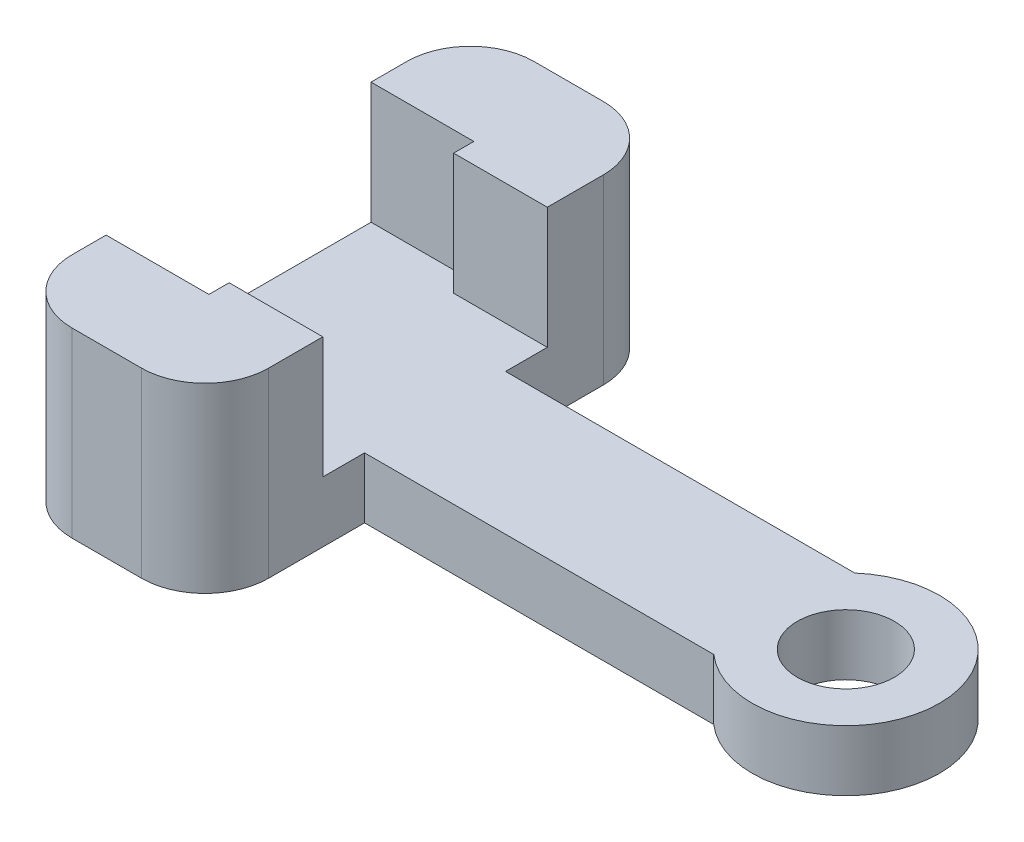
from build123d import *

# Parameters (mm, degrees)
CROQUIS1_R              = 2.4
SALIENTE_EXTRUIR1_DEPTH = 3
SALIENTE_EXTRUIR2_DEPTH = 6


with BuildPart() as part:
    # Croquis1 → Saliente-Extruir1 (new body)
    with BuildSketch(Plane(origin=(0, 0, 0), x_dir=(1, 0, 0), z_dir=(0, 1, 0))):
        with BuildLine():
            Line((35.117506554, -10.768616799), (17.851894103, -10.768616799))
            Line((17.851894103, -10.768616799), (17.851894103, -15.511473942))
            ThreePointArc((17.851894103, -15.511473942), (16.931372558, -17.73380954), (14.70903696, -18.654331085))
            Line((14.70903696, -18.654331085), (11.280465531, -18.654331085))
            ThreePointArc((11.280465531, -18.654331085), (9.058129933, -17.73380954), (8.137608389, -15.511473942))
            Line((8.137608389, -15.511473942), (8.137608389, 1.036415275))
            ThreePointArc((8.137608389, 1.036415275), (9.058129933, 3.258750873), (11.280465531, 4.179272418))
            Line((11.280465531, 4.179272418), (14.70903696, 4.179272418))
            ThreePointArc((14.70903696, 4.179272418), (16.931372558, 3.258750873), (17.851894103, 1.036415275))
            Line((17.851894103, 1.036415275), (17.851894103, -3.797188228))
            Line((17.851894103, -3.797188228), (35.117506554, -3.797188228))
            ThreePointArc((35.117506554, -3.797188228), (42.791315147, -7.282902513), (35.117506554, -10.768616799))
        make_face()
        with Locations(Location((38.162743718, -7.282902513, 0), (0, 0, 270))):
            Circle(CROQUIS1_R, mode=Mode.SUBTRACT)
    extrude(amount=SALIENTE_EXTRUIR1_DEPTH)

    # Croquis2 → Saliente-Extruir2 (add)
    with BuildSketch(Plane(origin=(0, 3, 0), x_dir=(1, 0, 0), z_dir=(0, 1, 0))):
        with BuildLine():
            Line((13.22040734, -0.732902513), (13.22040734, -1.732902513))
            Line((13.22040734, -1.732902513), (17.851894103, -1.732902513))
            Line((17.851894103, -1.732902513), (17.851894103, 1.036415275))
            ThreePointArc((17.851894103, 1.036415275), (16.931372558, 3.258750873), (14.70903696, 4.179272418))
            Line((14.70903696, 4.179272418), (11.280465531, 4.179272418))
            ThreePointArc((11.280465531, 4.179272418), (9.058129933, 3.258750873), (8.137608389, 1.036415275))
            Line((8.137608389, 1.036415275), (8.137608389, -0.732902513))
            Line((8.137608389, -0.732902513), (13.22040734, -0.732902513))
        make_face()
        with BuildLine():
            Line((17.851894103, -12.832902513), (13.22040734, -12.832902513))
            Line((13.22040734, -12.832902513), (13.22040734, -13.832902513))
            Line((13.22040734, -13.832902513), (8.137608389, -13.832902513))
            Line((8.137608389, -13.832902513), (8.137608389, -15.511473942))
            ThreePointArc((8.137608389, -15.511473942), (9.058129933, -17.73380954), (11.280465531, -18.654331085))
            Line((11.280465531, -18.654331085), (14.70903696, -18.654331085))
            ThreePointArc((14.70903696, -18.654331085), (16.931372558, -17.73380954), (17.851894103, -15.511473942))
            Line((17.851894103, -15.511473942), (17.851894103, -12.832902513))
        make_face()
    extrude(amount=SALIENTE_EXTRUIR2_DEPTH)


solid = part.part
